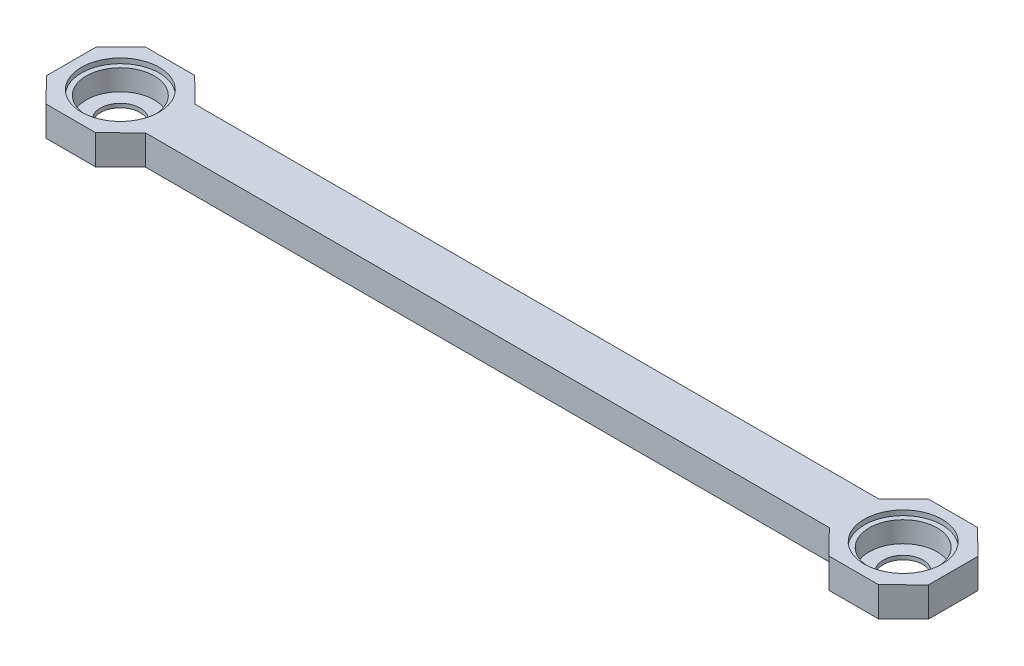
from build123d import *

# Parameters (mm, degrees)
SKETCH_1_R          = 4
EXTRUDE_1_DEPTH     = 6
SKETCH_2_R          = 6.85
CUT_EXTRUDE_1_DEPTH = 5.2
SKETCH_3_R          = 7.85
CUT_EXTRUDE_2_DEPTH = 1


with BuildPart() as part:
    # 草图1 → 凸台-拉伸1 (new body)
    with BuildSketch(Plane(origin=(0, 0, 0), x_dir=(1, 0, 0), z_dir=(0, 1, 0))):
        Polygon((-65.26232397, 5), (-70.363344484, 10), (-80.363344484, 10), (-85.26232397, 5), (-85.26232397, -5), (-80.363344484, -10), (-70.363344484, -10), (-65.26232397, -5), (72.73767603, -5), (77.636655516, -10), (87.636655516, -10), (92.739759147, -5), (92.739759147, 5), (87.636655516, 10), (77.636655516, 10), (72.73767603, 5), align=None)
        with Locations(Location((-75.363344484, 0, 0), (0, 0, 270))):
            Circle(SKETCH_1_R, mode=Mode.SUBTRACT)
        with Locations(Location((82.636655516, 0, 0), (0, 0, 270))):
            Circle(SKETCH_1_R, mode=Mode.SUBTRACT)
    extrude(amount=EXTRUDE_1_DEPTH)

    # 草图2 → 切除-拉伸1 (cut)
    with BuildSketch(Plane(origin=(0, 6, 0), x_dir=(1, 0, 0), z_dir=(0, 1, 0))):
        with Locations(Location((82.636655516, 0, 0), (0, 0, 270))):
            Circle(SKETCH_2_R)
        with Locations(Location((-75.363344484, 0, 0), (0, 0, 270))):
            Circle(SKETCH_2_R)
    extrude(amount=-CUT_EXTRUDE_1_DEPTH, mode=Mode.SUBTRACT)

    # 草图3 → 切除-拉伸2 (cut)
    with BuildSketch(Plane(origin=(0, 6, 0), x_dir=(1, 0, 0), z_dir=(0, 1, 0))):
        with Locations(Location((82.636655516, 0, 0), (0, 0, 270))):
            Circle(SKETCH_3_R)
        with Locations(Location((-75.363344484, 0, 0), (0, 0, 270))):
            Circle(SKETCH_3_R)
    extrude(amount=-CUT_EXTRUDE_2_DEPTH, mode=Mode.SUBTRACT)


solid = part.part
